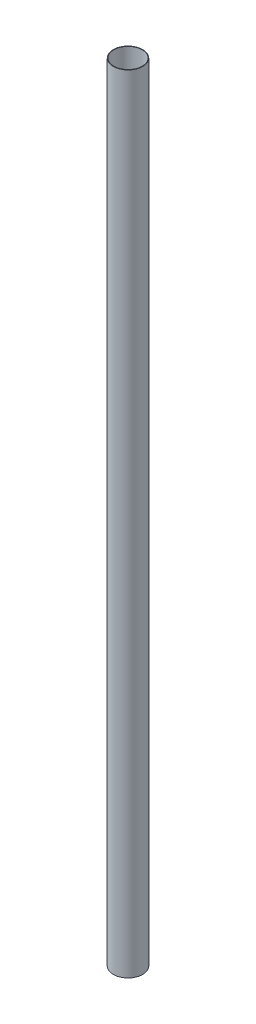
from build123d import *

# Parameters (mm, degrees)
SKETCH1_R           = 15.5
BOSS_EXTRUDE1_DEPTH = 830
SKETCH3_R           = 15
CUT_EXTRUDE2_DEPTH  = 931


with BuildPart() as part:
    # Sketch1 → Boss-Extrude1 (new body)
    with BuildSketch(Plane(origin=(0, 0, 0), x_dir=(1, 0, 0), z_dir=(0, 1, 0))):
        with Locations(Location((0, 0, 0), (0, 0, 270))):
            Circle(SKETCH1_R)
    extrude(amount=BOSS_EXTRUDE1_DEPTH)

    # Sketch3 → Cut-Extrude2 (cut)
    with BuildSketch(Plane(origin=(0, 830, 0), x_dir=(1, 0, 0), z_dir=(0, 1, 0))):
        with Locations(Location((0, 0, 0), (0, 0, 270))):
            Circle(SKETCH3_R)
    extrude(amount=-CUT_EXTRUDE2_DEPTH, mode=Mode.SUBTRACT)


solid = part.part
